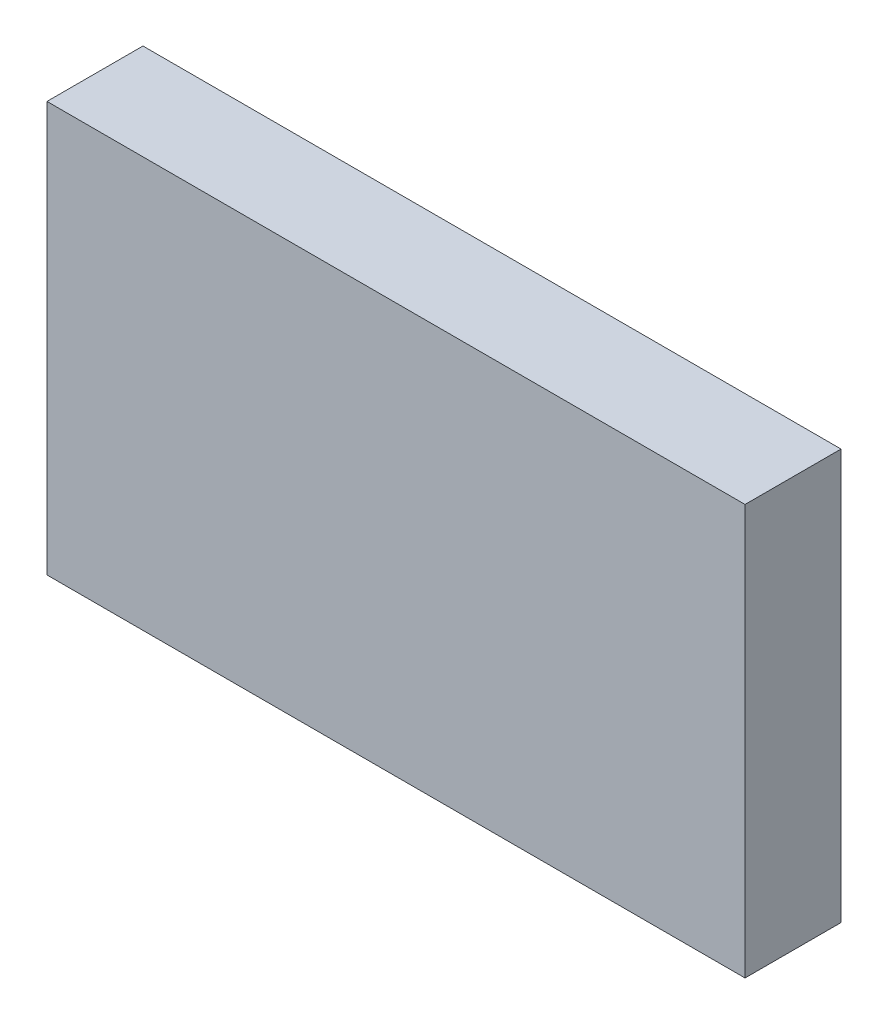
from build123d import *

# Parameters (mm, degrees)
SKETCH_1_W      = 32
SKETCH_1_H      = 18.8
EXTRUDE_1_DEPTH = 4.4


with BuildPart() as part:
    # 草图1 → 凸台-拉伸1 (new body)
    with BuildSketch(Plane.XY):
        Rectangle(SKETCH_1_W, SKETCH_1_H)
    extrude(amount=EXTRUDE_1_DEPTH)


solid = part.part
